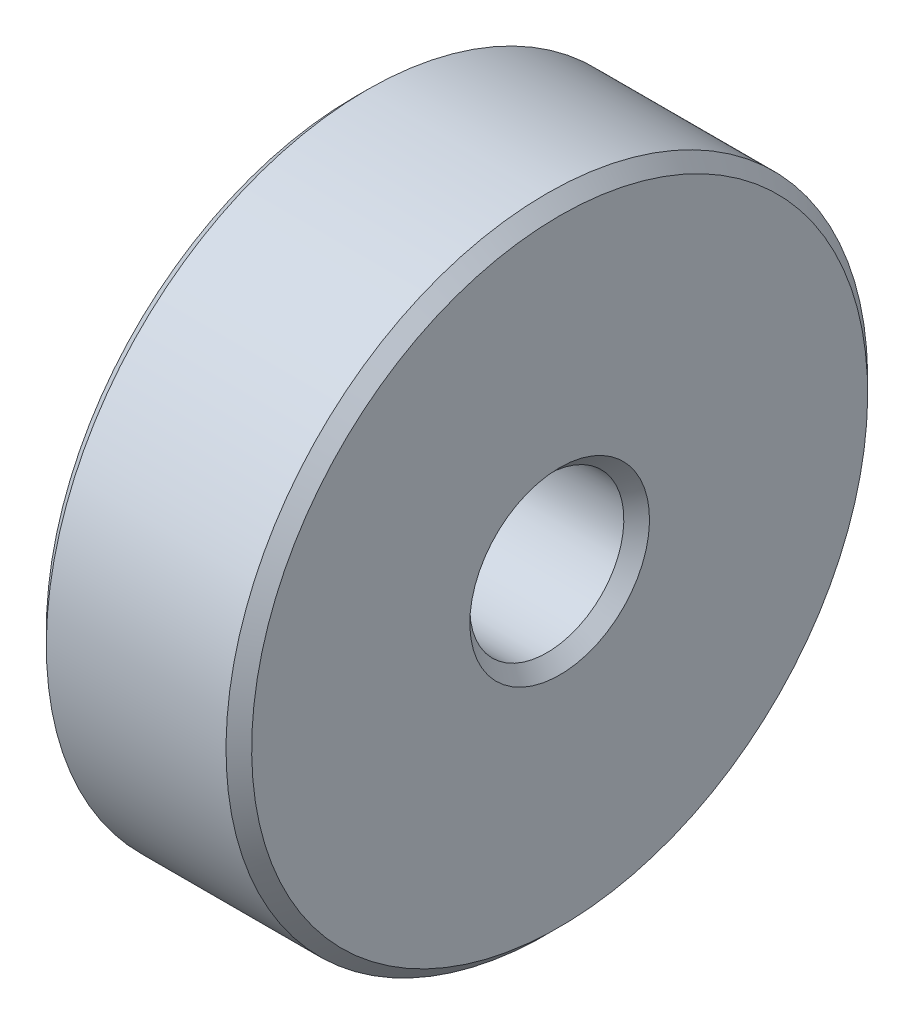
from build123d import *


with BuildPart() as part:
    # ｽｹｯﾁ1 → 回転1 (revolve)
    with BuildSketch(Plane.XY, mode=Mode.PRIVATE) as revolve_1_sk:
        Polygon((0, -3.5), (0, -12), (0.5, -12.5), (7.5, -12.5), (8, -12), (8, -3.5), (7.5, -3), (0.5, -3), align=None)
    revolve(revolve_1_sk.sketch.rotate(Axis((-3, 0, 0), (1, 0, 0)), 180), axis=Axis((-3, 0, 0), (1, 0, 0)))


solid = part.part
